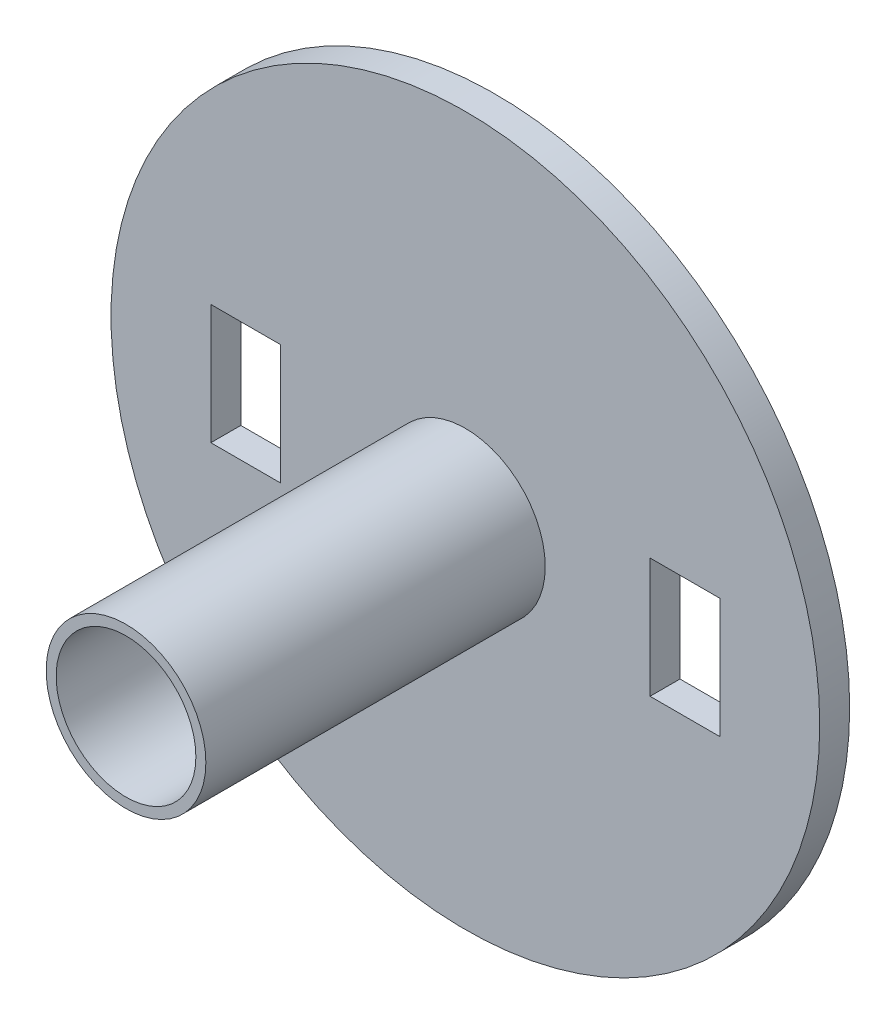
from build123d import *

# Parameters (mm, degrees)
SKETCH1_R           = 17.75
BOSS_EXTRUDE1_DEPTH = 1.5
SKETCH2_R           = 4
BOSS_EXTRUDE2_DEPTH = 17
SKETCH4_R           = 3.5
SKETCH4_W           = 3.5
SKETCH4_H           = 6
CUT_EXTRUDE1_DEPTH  = 32.182928022


with BuildPart() as part:
    # Sketch1 → Boss-Extrude1 (new body)
    with BuildSketch(Plane.XY):
        Circle(SKETCH1_R)
    extrude(amount=BOSS_EXTRUDE1_DEPTH)

    # Sketch2 → Boss-Extrude2 (add)
    with BuildSketch(Plane.XY.offset(1.5)):
        Circle(SKETCH2_R)
    extrude(amount=BOSS_EXTRUDE2_DEPTH)

    # Sketch4 → Cut-Extrude1 (cut, through all)
    with BuildSketch(Plane.XY.offset(18.5)):
        Circle(SKETCH4_R)
        with Locations((-11, 0)):
            Rectangle(SKETCH4_W, SKETCH4_H)
        with Locations((11, 0)):
            Rectangle(SKETCH4_W, SKETCH4_H)
    extrude(amount=-CUT_EXTRUDE1_DEPTH, mode=Mode.SUBTRACT)


solid = part.part
